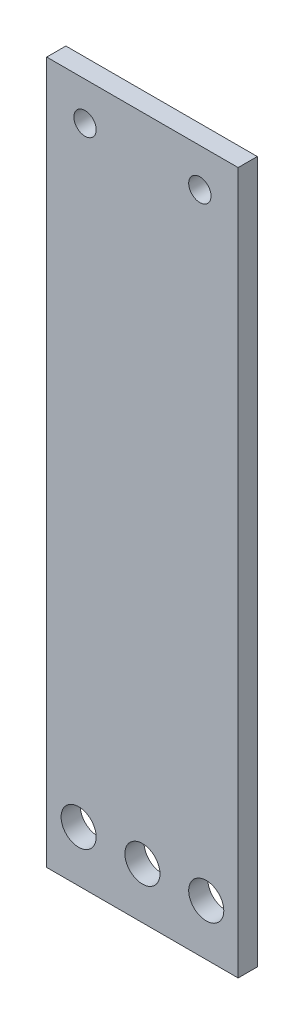
from build123d import *

# Parameters (mm, degrees)
SKETCH1_W           = 30
SKETCH1_H           = 110
SKETCH1_R           = 2.75
SKETCH1_R_2         = 1.75
BOSS_EXTRUDE1_DEPTH = 3


with BuildPart() as part:
    # Sketch1 → Boss-Extrude1 (new body)
    with BuildSketch(Plane.XY):
        with Locations((0, 55)):
            Rectangle(SKETCH1_W, SKETCH1_H)
        with Locations((10, 8)):
            Circle(SKETCH1_R, mode=Mode.SUBTRACT)
        with Locations((0, 8)):
            Circle(SKETCH1_R, mode=Mode.SUBTRACT)
        with Locations((-10, 8)):
            Circle(SKETCH1_R, mode=Mode.SUBTRACT)
        with Locations((-9, 104)):
            Circle(SKETCH1_R_2, mode=Mode.SUBTRACT)
        with Locations((9, 104)):
            Circle(SKETCH1_R_2, mode=Mode.SUBTRACT)
    extrude(amount=BOSS_EXTRUDE1_DEPTH)


solid = part.part
